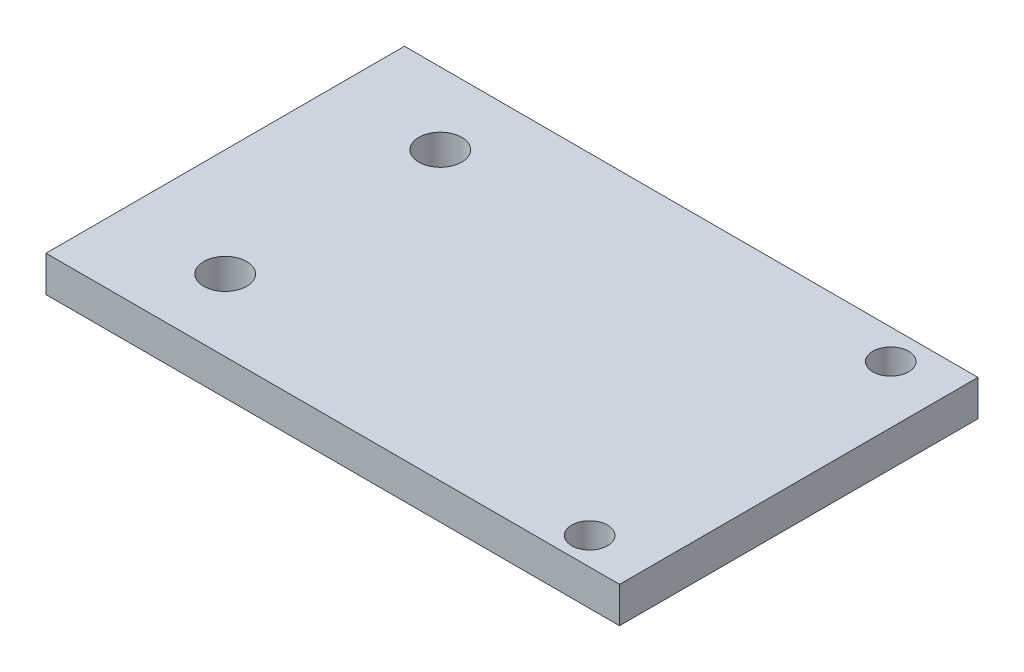
from build123d import *

# Parameters (mm, degrees)
SKETCH1_W           = 80
SKETCH1_H           = 50
SKETCH1_R           = 3
BOSS_EXTRUDE1_DEPTH = 5
SKETCH2_R           = 2.5
CUT_EXTRUDE1_DEPTH  = 10


with BuildPart() as part:
    # Sketch1 → Boss-Extrude1 (new body)
    with BuildSketch(Plane(origin=(0, 0, 0), x_dir=(1, 0, 0), z_dir=(0, 1, 0))):
        with Locations((40, 25)):
            Rectangle(SKETCH1_W, SKETCH1_H)
        with Locations(Location((15, 40, 0), (0, 0, 270))):
            Circle(SKETCH1_R, mode=Mode.SUBTRACT)
        with Locations(Location((15, 10, 0), (0, 0, 270))):
            Circle(SKETCH1_R, mode=Mode.SUBTRACT)
    extrude(amount=BOSS_EXTRUDE1_DEPTH)

    # Sketch2 → Cut-Extrude1 (cut)
    with BuildSketch(Plane(origin=(0, 5, 0), x_dir=(1, 0, 0), z_dir=(0, 1, 0))):
        with Locations(Location((72, 3.828026959, 0), (0, 0, 270))):
            Circle(SKETCH2_R)
        with Locations(Location((72, 45.828026959, 0), (0, 0, 270))):
            Circle(SKETCH2_R)
    extrude(amount=-CUT_EXTRUDE1_DEPTH, mode=Mode.SUBTRACT)


solid = part.part
